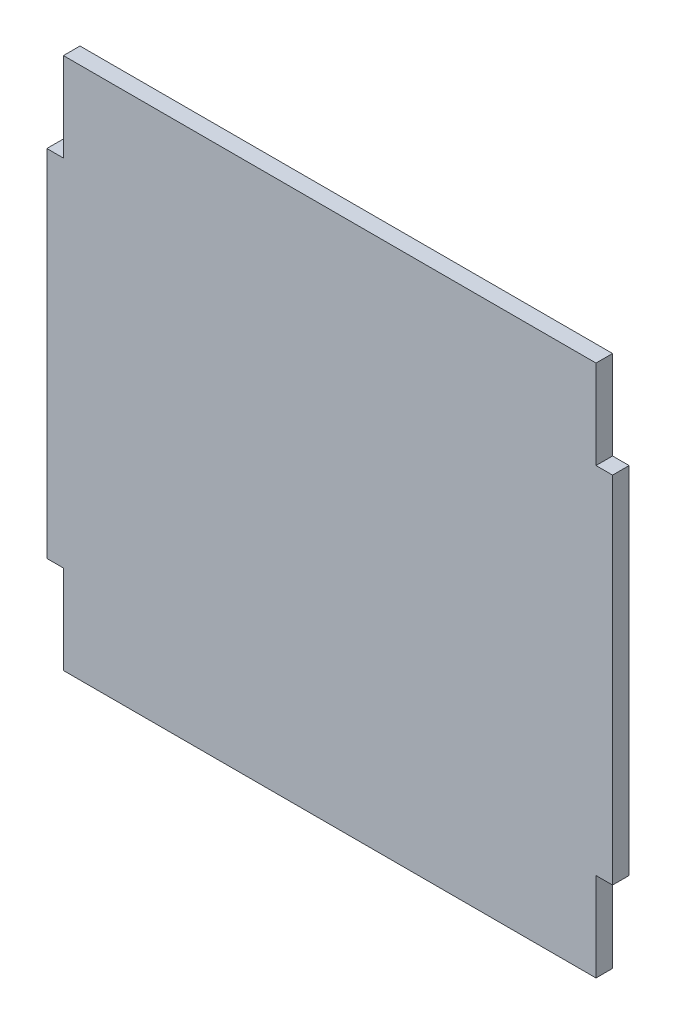
from build123d import *

# Parameters (mm, degrees)
EXTRUDE_1_DEPTH = 1.4


with BuildPart() as part:
    # Эскиз1 → Бобышка-Вытянуть1 (new, symmetric)
    with BuildSketch(Plane.XY):
        Polygon((-45, -45), (45, -45), (45, -30), (47.8, -30), (47.8, 30), (45, 30), (45, 45), (-45, 45), (-45, 30), (-47.8, 30), (-47.8, -30), (-45, -30), align=None)
    extrude(amount=EXTRUDE_1_DEPTH, both=True)


solid = part.part
